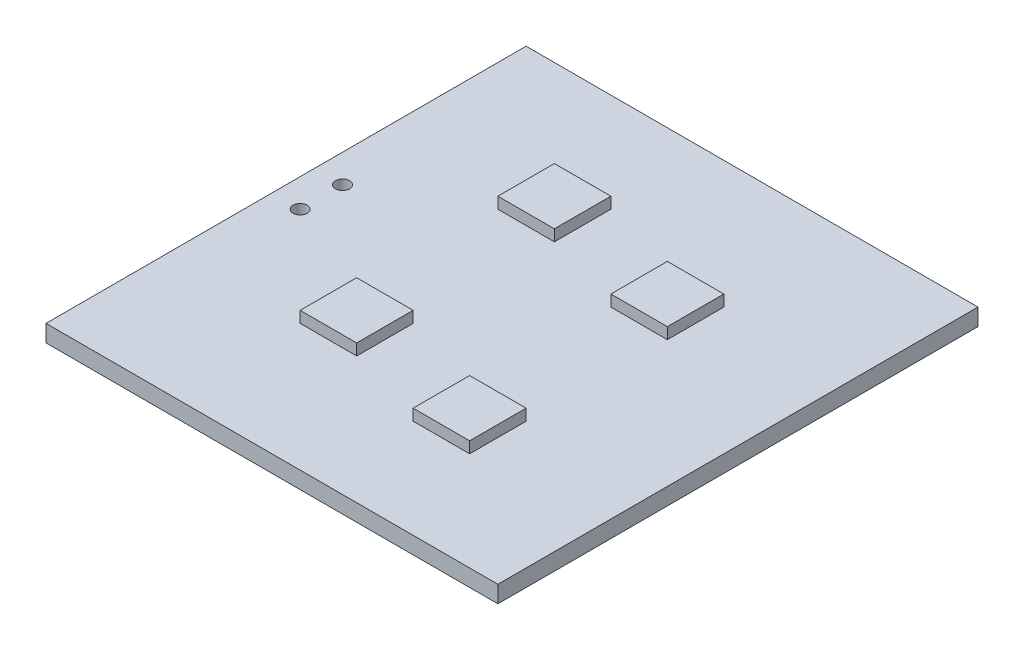
from build123d import *

# Parameters (mm, degrees)
SKETCH2_W           = 40.64
SKETCH2_H           = 43.18
BOSS_EXTRUDE1_DEPTH = 1.524
SKETCH3_R           = 0.635
CUT_EXTRUDE1_DEPTH  = 60.316478115
SKETCH4_W           = 5.08
SKETCH4_H           = 5.08
BOSS_EXTRUDE2_DEPTH = 1.016


with BuildPart() as part:
    # Sketch2 → Boss-Extrude1 (new body)
    with BuildSketch(Plane(origin=(0, 0, 0), x_dir=(1, 0, 0), z_dir=(0, 1, 0))):
        with Locations((20.32, 21.59)):
            Rectangle(SKETCH2_W, SKETCH2_H)
    extrude(amount=BOSS_EXTRUDE1_DEPTH)

    # Sketch3 → Cut-Extrude1 (cut, through all)
    with BuildSketch(Plane(origin=(0, 1.524, 0), x_dir=(1, 0, 0), z_dir=(0, 1, 0))):
        with Locations(Location((2.54, 24.13, 0), (0, 0, 270))):
            Circle(SKETCH3_R)
        with Locations(Location((2.54, 20.32, 0), (0, 0, 270))):
            Circle(SKETCH3_R)
    extrude(amount=-CUT_EXTRUDE1_DEPTH, mode=Mode.SUBTRACT)

    # Sketch4 → Boss-Extrude2 (add)
    with BuildSketch(Plane(origin=(0, 1.524, 0), x_dir=(1, 0, 0), z_dir=(0, 1, 0))):
        with Locations((13.97, 31.75)):
            Rectangle(SKETCH4_W, SKETCH4_H)
        with Locations((26.67, 29.21)):
            Rectangle(SKETCH4_W, SKETCH4_H)
        with Locations((13.97, 13.97)):
            Rectangle(SKETCH4_W, SKETCH4_H)
        with Locations((26.67, 11.43)):
            Rectangle(SKETCH4_W, SKETCH4_H)
    extrude(amount=BOSS_EXTRUDE2_DEPTH)


solid = part.part
